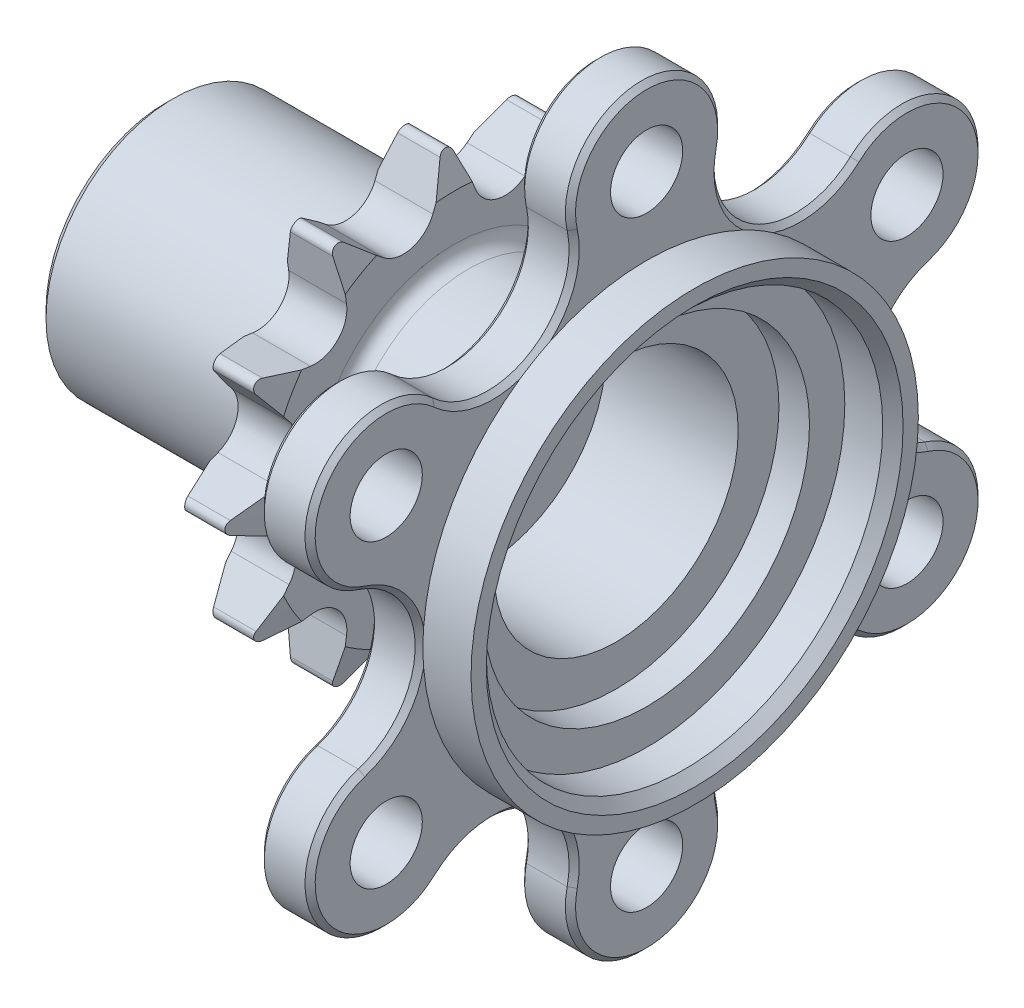
from build123d import *

# Parameters (mm, degrees)
SKETCH1_R              = 47
BASE_EXTRUDE_DEPTH     = 6.35
M8_CLEARANCE_HOLES_D   = 9
CIRPATTERN_COUNT       = 6
CUT_EXTRUDE_DEPTH      = 67.770670957
CUT_EXTRUDE_DEPTH_BACK = 67.770670957
CHAMFER1_SIZE          = 0.635
SKETCH8_R              = 15.875
SHAFT_EXTRUDE_DEPTH    = 53.690000062
SKETCH33_W             = 7.214
SKETCH33_H             = 27.5082
CUT_EXTRUDE1_DEPTH     = 98.73309917
CIRPATTERN1_COUNT      = 12
CHAMFER3_SIZE          = 0.635
M10_TAP_D              = 8.5
M10_TAP_CSINK_D        = 10.05
M10_TAP_CSINK_ANGLE    = 90
SHAFT_CHAMFER_SIZE     = 1
SKETCH30_R             = 27.89936
SKETCH30_R_2           = 24.72436
LIP_EXTRUDE_DEPTH      = 5.99948
LIP_CHAMFER_SIZE       = 1.27
FILLET2_R              = 3.000000096
FILLET3_R              = 1.778
SKETCH46_R             = 15.24
CUT_EXTRUDE2_DEPTH     = 20.32
SKETCH47_R             = 20.32
CUT_EXTRUDE3_DEPTH     = 3.81


with BuildPart() as part:
    # Sketch1 → Base-Extrude (new body)
    with BuildSketch(Plane(origin=(0, 0, 0), x_dir=(0, 0, -1), z_dir=(1, 0, 0))):
        Circle(SKETCH1_R)
    extrude(amount=-BASE_EXTRUDE_DEPTH)

    # M8 Clearance Holes (through all)
    with Locations(Plane(origin=(0, 0, 0), x_dir=(0, 0, -1), z_dir=(1, 0, 0))):
        with Locations((0, -37.5)):
            m8_clearance_holes = Hole(M8_CLEARANCE_HOLES_D / 2)

    # CirPattern: M8 Clearance Holes ×6 about axis
    cirpattern_axis = Axis((0, 0, 0), (1, 0, 0))
    for i in range(1, CIRPATTERN_COUNT):
        add(m8_clearance_holes.rotate(cirpattern_axis, i * 360 / CIRPATTERN_COUNT), mode=Mode.SUBTRACT)

    # Sketch19 → Cut-Extrude (cut, two sides: drawn at the far end of the back side and taken through both)
    with BuildSketch(Plane(origin=(0, 0, 0), x_dir=(0, 0, -1), z_dir=(1, 0, 0)).offset(-CUT_EXTRUDE_DEPTH_BACK)):
        with BuildLine():
            ThreePointArc((9.274838239, 35.443941724), (14.114033661, 24.446223401), (26.057934823, 25.754216393))
            ThreePointArc((26.057934823, 25.754216393), (33.921184851, 28.139425108), (40.703194264, 23.499999504))
            ThreePointArc((40.703194264, 23.499999504), (23.500000227, 40.703193847), (-4.7e-08, 47))
            ThreePointArc((-4.7e-08, 47), (7.40886473, 43.446320157), (9.274838239, 35.443941724))
        make_face()
        with BuildLine():
            ThreePointArc((-26.057934823, 25.754216393), (-14.114033661, 24.446223401), (-9.274838239, 35.443941724))
            ThreePointArc((-9.274838239, 35.443941724), (-7.40886476, 43.44632012), (-4.7e-08, 47))
            ThreePointArc((-4.7e-08, 47), (-23.500000787, 40.703193523), (-40.703194863, 23.499998466))
            ThreePointArc((-40.703194863, 23.499998466), (-33.921185443, 28.139425017), (-26.057934823, 25.754216393))
        make_face()
        with BuildLine():
            ThreePointArc((40.703193464, -23.50000089), (47, -8e-07), (40.703194264, 23.499999504))
            ThreePointArc((40.703194264, 23.499999504), (41.33004921, 15.30689472), (35.332773062, 9.689725331))
            ThreePointArc((35.332773062, 9.689725331), (28.228067323, 0), (35.332773062, -9.689725331))
            ThreePointArc((35.332773062, -9.689725331), (41.330049499, -15.306895465), (40.703193464, -23.50000089))
        make_face()
        with BuildLine():
            ThreePointArc((-35.332773062, 9.689725331), (-41.330048992, 15.306894161), (-40.703194863, 23.499998466))
            ThreePointArc((-40.703194863, 23.499998466), (-47, -6.9e-08), (-40.703194794, -23.499998586))
            ThreePointArc((-40.703194794, -23.499998586), (-41.330049018, -15.306894226), (-35.332773062, -9.689725331))
            ThreePointArc((-35.332773062, -9.689725331), (-28.228067323, 0), (-35.332773062, 9.689725331))
        make_face()
        with BuildLine():
            ThreePointArc((-26.057934823, -25.754216393), (-33.921185375, -28.139425028), (-40.703194794, -23.499998586))
            ThreePointArc((-40.703194794, -23.499998586), (-23.500000688, -40.703193581), (4.4e-08, -47))
            ThreePointArc((4.4e-08, -47), (-7.408864732, -43.446320155), (-9.274838239, -35.443941724))
            ThreePointArc((-9.274838239, -35.443941724), (-14.114033661, -24.446223401), (-26.057934823, -25.754216393))
        make_face()
        with BuildLine():
            ThreePointArc((4.4e-08, -47), (23.499999574, -40.703194224), (40.703193464, -23.50000089))
            ThreePointArc((40.703193464, -23.50000089), (33.92118406, -28.13942523), (26.057934823, -25.754216393))
            ThreePointArc((26.057934823, -25.754216393), (14.114033661, -24.446223401), (9.274838239, -35.443941724))
            ThreePointArc((9.274838239, -35.443941724), (7.408864759, -43.446320121), (4.4e-08, -47))
        make_face()
    extrude(amount=CUT_EXTRUDE_DEPTH + CUT_EXTRUDE_DEPTH_BACK, mode=Mode.SUBTRACT)

    # Chamfer1
    chamfer1_edges = [part.edges().sort_by_distance(p)[0] for p in [
        (-6.35, -24.446223401, 14.114033661),
        (-6.35, 24.446223401, -14.114033661),
        (-6.35, 24.446223401, 14.114033661),
        (-6.35, 23.5, 40.703193978),
        (-6.35, 47, 0),
        (-6.35, -24.446223401, -14.114033661),
        (-6.35, -23.5, -40.703193978),
        (-6.35, -47, 0),
        (-6.35, 0, 28.228067323),
        (-6.35, -23.5, 40.703193978),
        (-6.35, 0, -28.228067323),
        (-6.35, 23.5, -40.703193978),
    ]]
    chamfer(chamfer1_edges, length=CHAMFER1_SIZE)

    # Sketch8 → Shaft-Extrude (add)
    with BuildSketch(Plane.ZY.offset(6.35)):
        with Locations(Location((0, 0, 0), (0, 0, 180))):
            Circle(SKETCH8_R)
    extrude(amount=SHAFT_EXTRUDE_DEPTH)

    # Sketch33 → Revolve1 (revolve)
    with BuildSketch(Plane(origin=(0, 0, 0), x_dir=(1, 0, 0), z_dir=(0, 1, 0))):
        with Locations((-27.607000006, 13.7541)):
            Rectangle(SKETCH33_W, SKETCH33_H)
    revolve(axis=Axis((-24.000000006, 0, 0), (-1, 0, 0)))

    # Sketch40 → Cut-Extrude1 (cut, through all)
    with BuildSketch(Plane(origin=(-24.000000006, -33.5661, 0), x_dir=(0, 0, 1), z_dir=(-1, 0, 0))):
        with BuildLine():
            Line((-0.805715716, 60.525849783), (-2.663822441, 55.812102806))
            ThreePointArc((-2.663822441, 55.812102806), (-5.324614334, 53.437831224), (-8.816063498, 54.163614783))
            Line((-8.816063498, 54.163614783), (-12.782104613, 57.316786049))
            ThreePointArc((-12.782104613, 57.316786049), (-13.256994885, 57.50255554), (-13.7541, 57.388900012))
            ThreePointArc((-13.7541, 57.388900012), (-7.119646056, 60.136980815), (0, 61.0743))
            ThreePointArc((0, 61.0743), (-0.487333422, 60.924176017), (-0.805715716, 60.525849783))
        make_face()
    cut_extrude1 = extrude(amount=CUT_EXTRUDE1_DEPTH, mode=Mode.SUBTRACT)

    # CirPattern1: Cut-Extrude1 ×12 about axis
    cirpattern1_axis = Axis((0, 0, 0), (1, 0, 0))
    for i in range(1, CIRPATTERN1_COUNT):
        add(cut_extrude1.rotate(cirpattern1_axis, i * 360 / CIRPATTERN1_COUNT), mode=Mode.SUBTRACT)

    # Chamfer3
    chamfer3_edges = [part.edges().sort_by_distance(p)[0] for p in [
        (0, 24.446223401, -14.114033661),
        (0, -24.446223401, 14.114033661),
        (0, -24.446223401, -14.114033661),
        (0, -47, 0),
        (0, -23.5, -40.703193978),
        (0, 24.446223401, 14.114033661),
        (0, 47, 0),
        (0, 23.5, 40.703193978),
        (0, 0, -28.228067323),
        (0, 23.5, -40.703193978),
        (0, 0, 28.228067323),
        (0, -23.5, 40.703193978),
    ]]
    chamfer(chamfer3_edges, length=CHAMFER3_SIZE)

    # M10 Tap (through all)
    with Locations(Plane.ZY.offset(60.040000062)):
        with Locations((0, 0)):
            CounterSinkHole(M10_TAP_D / 2, M10_TAP_CSINK_D / 2, counter_sink_angle=M10_TAP_CSINK_ANGLE)

    # Shaft Chamfer
    shaft_chamfer_edges = [part.edges().sort_by_distance(p)[0] for p in [
        (-60.040000062, 0, 15.875),
    ]]
    chamfer(shaft_chamfer_edges, length=SHAFT_CHAMFER_SIZE)

    # Sketch30 → Lip Extrude (add)
    with BuildSketch(Plane(origin=(0, 0, 0), x_dir=(0, 0, -1), z_dir=(1, 0, 0))):
        with Locations(Location((0, 0, 0), (0, 0, 175.528743947))):
            Circle(SKETCH30_R)
        with Locations(Location((0, 0, 0), (0, 0, 180))):
            Circle(SKETCH30_R_2, mode=Mode.SUBTRACT)
    extrude(amount=LIP_EXTRUDE_DEPTH)

    # Lip Chamfer
    lip_chamfer_edges = [part.edges().sort_by_distance(p)[0] for p in [
        (5.99948, 0, -24.72436),
    ]]
    chamfer(lip_chamfer_edges, length=LIP_CHAMFER_SIZE)

    # Fillet2
    fillet2_edges = [part.edges().sort_by_distance(p)[0] for p in [
        (-6.35, 0, 15.875),
    ]]
    fillet(fillet2_edges, radius=FILLET2_R)

    # Fillet3
    fillet3_edges = [part.edges().sort_by_distance(p)[0] for p in [
        (-24.000000006, 0, 15.875),
        (-31.214000006, 0, 15.875),
    ]]
    fillet(fillet3_edges, radius=FILLET3_R)

    # Sketch45 → Cut-Revolve1 (revolve, cut)
    with BuildSketch(Plane(origin=(0, 0, 0), x_dir=(1, 0, 0), z_dir=(0, 1, 0)), mode=Mode.PRIVATE) as cut_revolve1_sk:
        Polygon((-31.214000006, 27.5082), (-30.109498123, 27.5082), (-31.214000006, 23.386142857), align=None)
        Polygon((-24.000000006, 27.5082), (-25.104501889, 27.5082), (-24.000000006, 23.386142857), align=None)
    revolve(cut_revolve1_sk.sketch.rotate(Axis((25.052436988, 0, 0), (-1, 0, 0)), 180), axis=Axis((25.052436988, 0, 0), (-1, 0, 0)), mode=Mode.SUBTRACT)

    # Sketch46 → Cut-Extrude2 (cut)
    with BuildSketch(Plane(origin=(0, 0, 0), x_dir=(0, 0, -1), z_dir=(1, 0, 0))):
        Circle(SKETCH46_R)
    extrude(amount=-CUT_EXTRUDE2_DEPTH, mode=Mode.SUBTRACT)

    # Sketch47 → Cut-Extrude3 (cut)
    with BuildSketch(Plane(origin=(0, 0, 0), x_dir=(0, 0, -1), z_dir=(1, 0, 0))):
        Circle(SKETCH47_R)
    extrude(amount=-CUT_EXTRUDE3_DEPTH, mode=Mode.SUBTRACT)


solid = part.part
